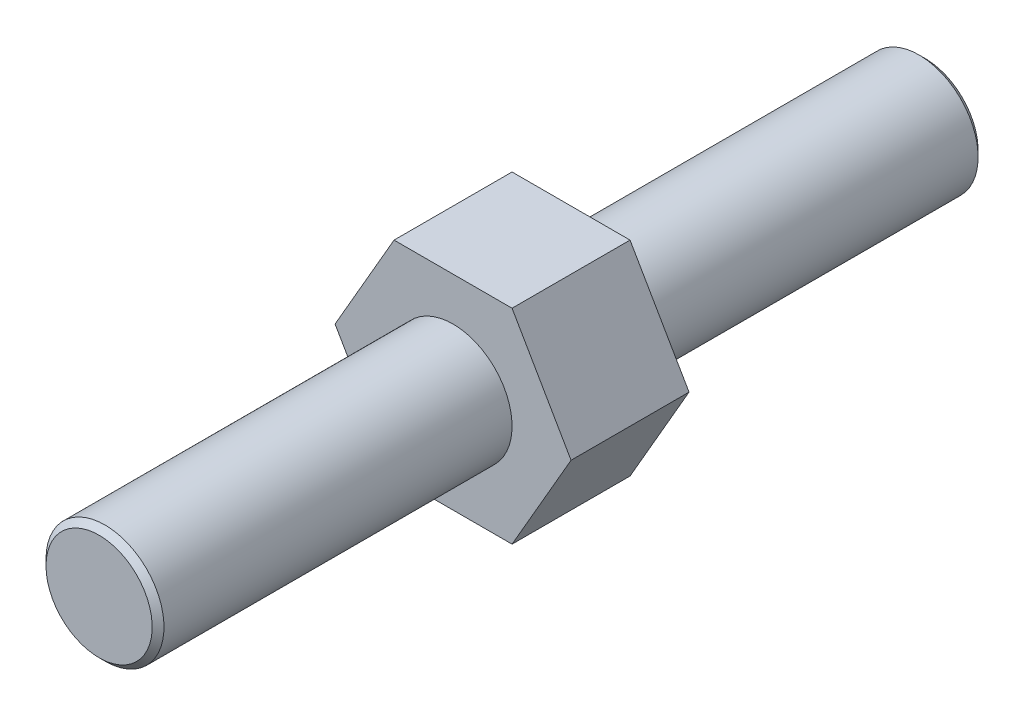
from build123d import *

# Parameters (mm, degrees)
BOSS_EXTRU_1_DEPTH = 10


with BuildPart() as part:
    # Esquisse1 → Boss.-Extru.1 (new body)
    with BuildSketch(Plane.XY):
        Polygon((-10, 17.320508076), (10, 17.320508076), (20, 0), (10, -17.320508076), (-10, -17.320508076), (-20, 0), align=None)
    boss_extru_1 = extrude(amount=BOSS_EXTRU_1_DEPTH)

    # Esquisse2 → Révolution1 (revolve)
    with BuildSketch(Plane(origin=(0, 0, 0), x_dir=(1, 0, 0), z_dir=(0, 1, 0)), mode=Mode.PRIVATE) as r_volution1_sk:
        Polygon((0, -10), (0, -70), (9, -70), (10, -69), (10, -10), align=None)
    r_volution1 = revolve(r_volution1_sk.sketch.rotate(Axis((0, 0, 10), (0, 0, 1)), 180), axis=Axis((0, 0, 10), (0, 0, 1)))

    # Symétrie1: Boss.-Extru.1, Révolution1 across plane
    add(boss_extru_1.mirror(Plane(origin=(0, 0, 0), x_dir=(1, 0, 0), z_dir=(0, 0, -1))))
    add(r_volution1.mirror(Plane(origin=(0, 0, 0), x_dir=(1, 0, 0), z_dir=(0, 0, -1))))


solid = part.part
